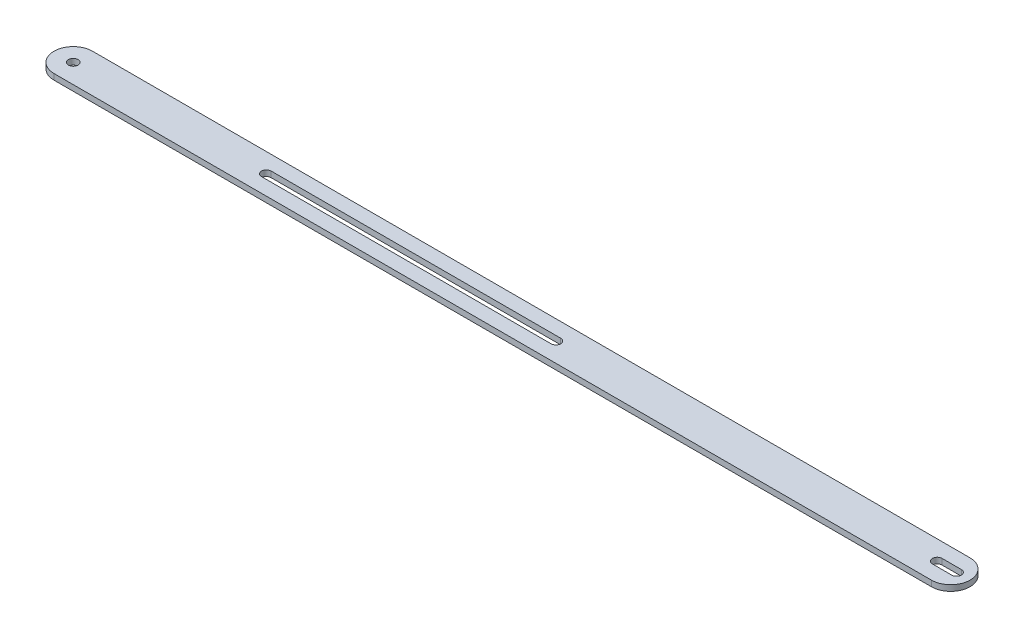
from build123d import *

# Parameters (mm, degrees)
SKETCH1_R           = 2.5
BOSS_EXTRUDE1_DEPTH = 3
CUT_EXTRUDE1_DEPTH  = 238.479604387


with BuildPart() as part:
    # Sketch1 → Boss-Extrude1 (new body)
    with BuildSketch(Plane(origin=(0, 0, 0), x_dir=(1, 0, 0), z_dir=(0, 1, 0))):
        with BuildLine():
            Line((-227.25, 10), (227.25, 10))
            ThreePointArc((227.25, 10), (237.25, 0), (227.25, -10))
            Line((227.25, -10), (-227.25, -10))
            ThreePointArc((-227.25, -10), (-237.25, 0), (-227.25, 10))
        make_face()
        with Locations(Location((-227.25, 0, 0), (0, 0, 270))):
            Circle(SKETCH1_R, mode=Mode.SUBTRACT)
        with BuildLine():
            Line((230.25, -2.5), (220.25, -2.5))
            ThreePointArc((220.25, -2.5), (217.75, 0), (220.25, 2.5))
            Line((220.25, 2.5), (230.25, 2.5))
            ThreePointArc((230.25, 2.5), (232.75, 0), (230.25, -2.5))
        make_face(mode=Mode.SUBTRACT)
    extrude(amount=BOSS_EXTRUDE1_DEPTH)

    # Sketch2 → Cut-Extrude1 (cut, through all)
    with BuildSketch(Plane(origin=(0, 3, 0), x_dir=(1, 0, 0), z_dir=(0, 1, 0))):
        with BuildLine():
            Line((-127.25, 2.5), (22.75, 2.5))
            ThreePointArc((22.75, 2.5), (25.25, 0), (22.75, -2.5))
            Line((22.75, -2.5), (-127.25, -2.5))
            ThreePointArc((-127.25, -2.5), (-129.75, 0), (-127.25, 2.5))
        make_face()
    extrude(amount=-CUT_EXTRUDE1_DEPTH, mode=Mode.SUBTRACT)


solid = part.part
